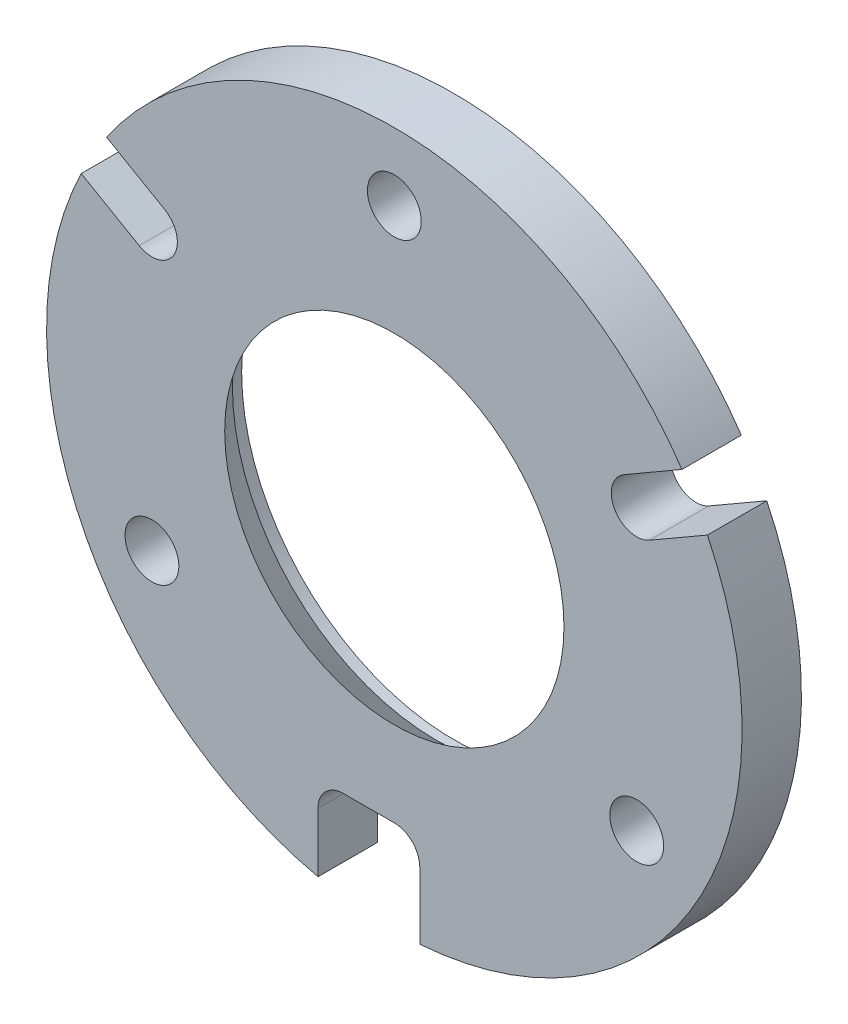
from build123d import *

# Parameters (mm, degrees)
SKETCH1_R          = 20.5
SKETCH1_R_2        = 12.5
SKETCH1_R_3        = 1.5875
EXTRUDE1_DEPTH     = 5
CUT_EXTRUDE1_DEPTH = 30.419381367
CIRPATTERN1_COUNT  = 3
SKETCH3_W          = 2.5
SKETCH3_H          = 2.5
SKETCH4_W          = 20.5
SKETCH4_H          = 1.5
CUT_EXTRUDE2_DEPTH = 30.201883501


with BuildPart() as part:
    # Sketch1 → Extrude1 (new body)
    with BuildSketch(Plane.XY):
        Circle(SKETCH1_R)
        Circle(SKETCH1_R_2, mode=Mode.SUBTRACT)
        with Locations((0, 16.5)):
            Circle(SKETCH1_R_3, mode=Mode.SUBTRACT)
        with Locations((14.289419162, -8.25)):
            Circle(SKETCH1_R_3, mode=Mode.SUBTRACT)
        with Locations((-14.289419162, -8.25)):
            Circle(SKETCH1_R_3, mode=Mode.SUBTRACT)
    extrude(amount=EXTRUDE1_DEPTH)

    # Sketch2 → Cut-Extrude1 (cut, through all)
    with BuildSketch(Plane.XY.offset(5)):
        with BuildLine():
            ThreePointArc((1.5, -16.5), (0, -15), (-1.5, -16.5))
            Line((-1.5, -16.5), (-1.5, -20.4450483))
            ThreePointArc((-1.5, -20.4450483), (0, -20.5), (1.5, -20.4450483))
            Line((1.5, -20.4450483), (1.5, -16.5))
        make_face()
    cut_extrude1 = extrude(amount=-CUT_EXTRUDE1_DEPTH, mode=Mode.SUBTRACT)

    # CirPattern1: Cut-Extrude1 ×3 about axis
    cirpattern1_axis = Axis((0, 0, 5), (0, 0, -1))
    for i in range(1, CIRPATTERN1_COUNT):
        add(cut_extrude1.rotate(cirpattern1_axis, i * 360 / CIRPATTERN1_COUNT), mode=Mode.SUBTRACT)

    # Sketch3 → Revolve1 (revolve)
    with BuildSketch(Plane(origin=(0, 0, 0), x_dir=(1, 0, 0), z_dir=(0, 1, 0))):
        with Locations((-11.25, -3.75)):
            Rectangle(SKETCH3_W, SKETCH3_H)
    revolve(axis=Axis((0, 0, 0), (0, 0, 1)))

    # Sketch4 → Cut-Revolve1 (revolve, cut)
    with BuildSketch(Plane(origin=(0, 0, 0), x_dir=(1, 0, 0), z_dir=(0, 1, 0))):
        with Locations((-10.25, -0.75)):
            Rectangle(SKETCH4_W, SKETCH4_H)
    revolve(axis=Axis((0, 0, 0), (0, 0, 1)), mode=Mode.SUBTRACT)

    # Sketch5 → Cut-Extrude2 (cut, through all)
    with BuildSketch(Plane.XY.offset(5)):
        with BuildLine():
            ThreePointArc((-1.5, -16.5), (-1.060660172, -15.439339828), (0, -15))
            Line((0, -15), (-3, -15))
            ThreePointArc((-3, -15), (-4.060660172, -15.439339828), (-4.5, -16.5))
            Line((-4.5, -16.5), (-4.5, -20))
            ThreePointArc((-4.5, -20), (-3.008241512, -20.278078878), (-1.5, -20.4450483))
            Line((-1.5, -20.4450483), (-1.5, -16.5))
        make_face()
    extrude(amount=-CUT_EXTRUDE2_DEPTH, mode=Mode.SUBTRACT)

    # Sketch6 → Cut-Revolve2 (revolve, cut)
    with BuildSketch(Plane(origin=(0, 0, 0), x_dir=(1, 0, 0), z_dir=(0, 1, 0))):
        Polygon((-10, -5), (-12.045348365, -2.5), (-10, -2.5), align=None)
    revolve(axis=Axis((0, 0, 0), (0, 0, 1)), mode=Mode.SUBTRACT)


solid = part.part
